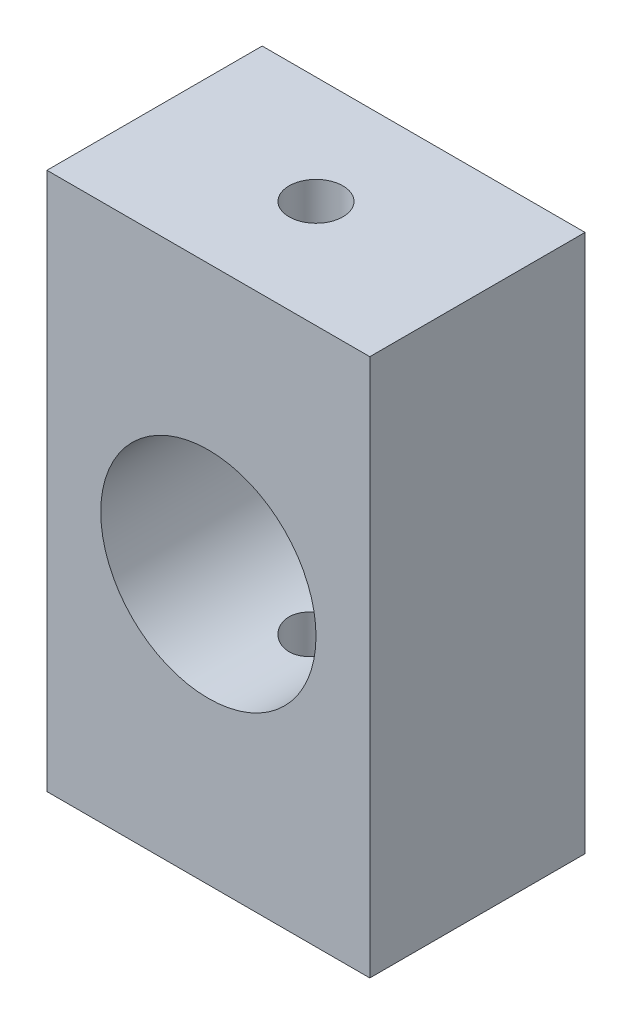
from build123d import *

# Parameters (mm, degrees)
IZIM1_W                     = 30
IZIM1_H                     = 50
IZIM1_R                     = 10
Y_KSEKLIK_EKSTR_ZYON1_DEPTH = 20
KES_EKSTR_ZYON1_REACH       = 57.902
IZIM2_R                     = 2.5


with BuildPart() as part:
    # Çizim1 → Yükseklik-Ekstrüzyon1 (new body)
    with BuildSketch(Plane.XY):
        Rectangle(IZIM1_W, IZIM1_H)
        Circle(IZIM1_R, mode=Mode.SUBTRACT)
    extrude(amount=Y_KSEKLIK_EKSTR_ZYON1_DEPTH)

    # Kes-Ekstrüzyon1: up to this face of the body (flat: up to its plane)
    kes_ekstr_zyon1_end = Plane(part.part.faces().sort_by_distance((0, -25, 10))[0])
    # Çizim2 → Kes-Ekstrüzyon1 (cut, up to the picked face)
    with BuildSketch(Plane(origin=(0, 25, 0), x_dir=(1, 0, 0), z_dir=(0, 1, 0)), mode=Mode.PRIVATE) as kes_ekstr_zyon1_sk1:
        with Locations(Location((0, -10, 0), (0, 0, 180))):
            Circle(IZIM2_R)
    kes_ekstr_zyon1_tool1 = split(extrude(kes_ekstr_zyon1_sk1.sketch, amount=-KES_EKSTR_ZYON1_REACH, mode=Mode.PRIVATE), bisect_by=kes_ekstr_zyon1_end, keep=Keep.BOTH, mode=Mode.PRIVATE)
    add(kes_ekstr_zyon1_tool1.solids().sort_by(Axis((0, 25, 10), (0, -1, 0)))[0], mode=Mode.SUBTRACT)


solid = part.part
